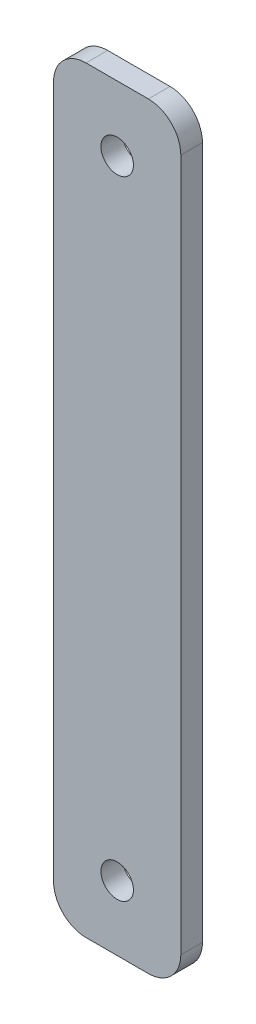
from build123d import *

# Parameters (mm, degrees)
SKETCH1_R           = 1.5
BOSS_EXTRUDE1_DEPTH = 2


with BuildPart() as part:
    # Sketch1 → Boss-Extrude1 (new body)
    with BuildSketch(Plane.XY):
        with BuildLine():
            Line((2.88, -35), (-2.88, -35))
            ThreePointArc((-2.88, -35), (-5.001320344, -34.121320344), (-5.88, -32))
            Line((-5.88, -32), (-5.88, 32))
            ThreePointArc((-5.88, 32), (-5.001320344, 34.121320344), (-2.88, 35))
            Line((-2.88, 35), (2.88, 35))
            ThreePointArc((2.88, 35), (5.001320344, 34.121320344), (5.88, 32))
            Line((5.88, 32), (5.88, -32))
            ThreePointArc((5.88, -32), (5.001320344, -34.121320344), (2.88, -35))
        make_face()
        with Locations((0, -29)):
            Circle(SKETCH1_R, mode=Mode.SUBTRACT)
        with Locations((0, 29)):
            Circle(SKETCH1_R, mode=Mode.SUBTRACT)
    extrude(amount=BOSS_EXTRUDE1_DEPTH)


solid = part.part
